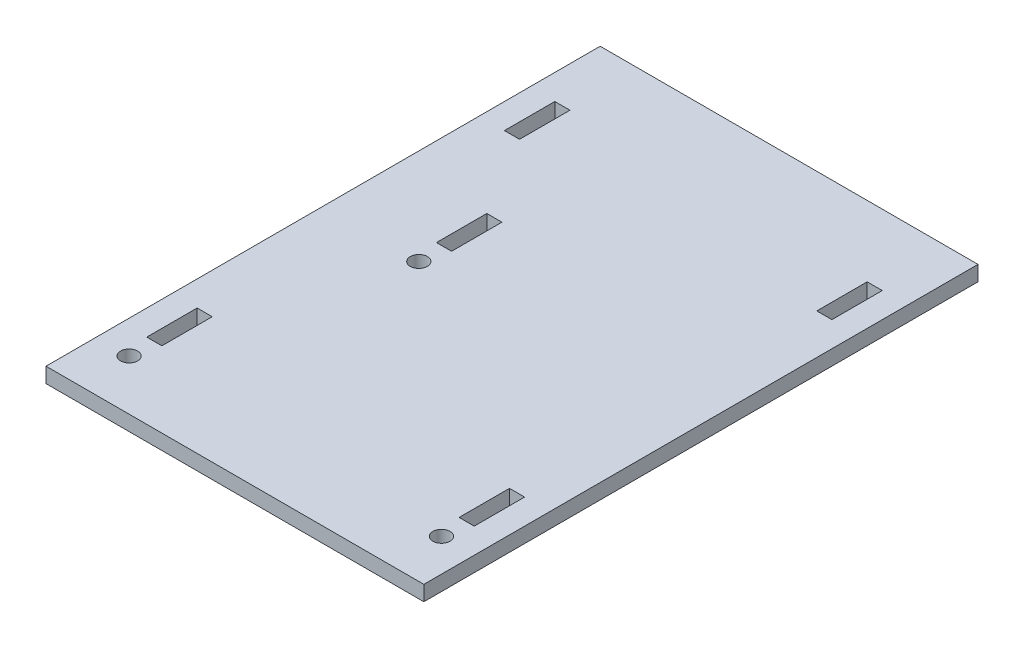
from build123d import *

# Parameters (mm, degrees)
SKETCH1_W                = 75
SKETCH1_H                = 110
BOSS_EXTRUDE1_DEPTH      = 3
SKETCH2_W                = 3
SKETCH2_H                = 10
CUT_EXTRUDE1_DEPTH       = 3
M3_CLEARANCE_HOLE1_D     = 3.4
M3_CLEARANCE_HOLE1_DEPTH = 3
M3_CLEARANCE_HOLE1_TIP   = 1.021463052


with BuildPart() as part:
    # Sketch1 → Boss-Extrude1 (new body)
    with BuildSketch(Plane(origin=(0, 0, 0), x_dir=(1, 0, 0), z_dir=(0, 1, 0))):
        with Locations((37.5, 55)):
            Rectangle(SKETCH1_W, SKETCH1_H)
    extrude(amount=BOSS_EXTRUDE1_DEPTH)

    # Sketch2 → Cut-Extrude1 (cut)
    with BuildSketch(Plane(origin=(0, 3, 0), x_dir=(1, 0, 0), z_dir=(0, 1, 0))):
        with Locations((6.5, 91)):
            Rectangle(SKETCH2_W, SKETCH2_H)
        with Locations((68.5, 91)):
            Rectangle(SKETCH2_W, SKETCH2_H)
        with Locations((68.5, 20)):
            Rectangle(SKETCH2_W, SKETCH2_H)
        with Locations((6.5, 20)):
            Rectangle(SKETCH2_W, SKETCH2_H)
        with Locations((19, 65)):
            Rectangle(SKETCH2_W, SKETCH2_H)
    extrude(amount=-CUT_EXTRUDE1_DEPTH, mode=Mode.SUBTRACT)

    # M3 Clearance Hole1
    with Locations(Plane(origin=(0, 3, 0), x_dir=(1, 0, 0), z_dir=(0, 1, 0))):
        with Locations((6.5, 10), (68.5, 10), (19, 55)):
            Hole(M3_CLEARANCE_HOLE1_D / 2, depth=M3_CLEARANCE_HOLE1_DEPTH)
            with Locations((0, 0, -(M3_CLEARANCE_HOLE1_DEPTH + M3_CLEARANCE_HOLE1_TIP / 2))):  # 118° drill point
                Cone(0, M3_CLEARANCE_HOLE1_D / 2, M3_CLEARANCE_HOLE1_TIP, mode=Mode.SUBTRACT)


solid = part.part
